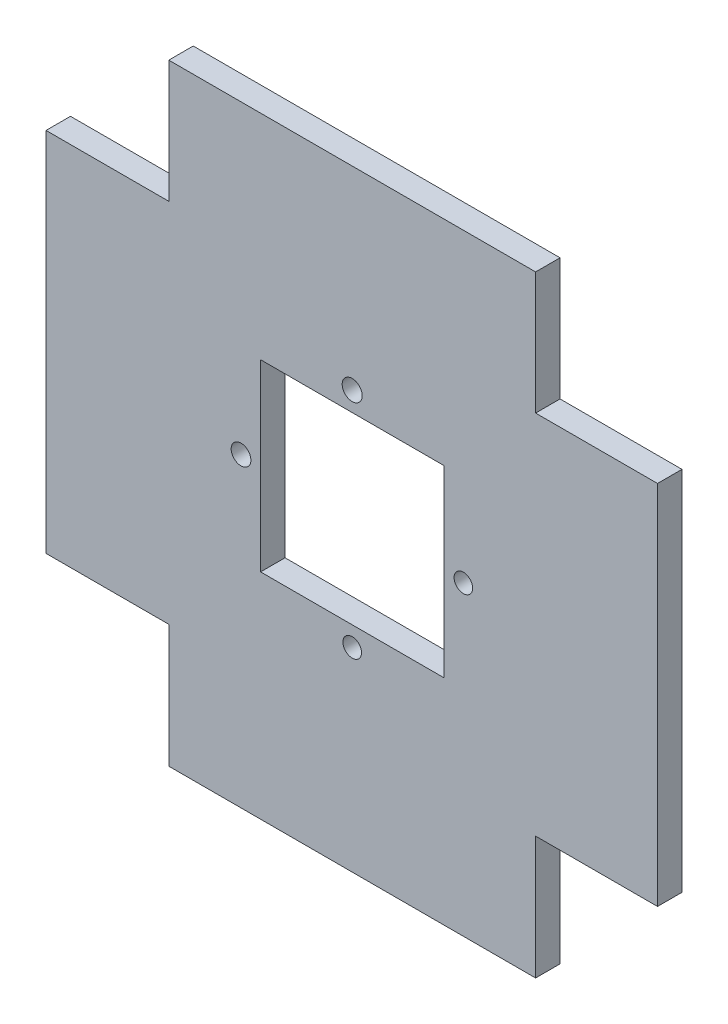
from build123d import *

# Parameters (mm, degrees)
SKETCH2_R           = 2.08028948
SKETCH2_R_2         = 1.930605223
SKETCH2_R_3         = 1.931643465
SKETCH2_R_4         = 2.051960052
SKETCH2_W           = 38.050309674
SKETCH2_H           = 38.166973502
BOSS_EXTRUDE1_DEPTH = 5.08


with BuildPart() as part:
    # Sketch2 → Boss-Extrude1 (new body)
    with BuildSketch(Plane.XY):
        Polygon((49.372044396, 30.512685118), (-26.811291054, 30.512685118), (-26.811291054, 5.122215891), (-52.307460203, 5.122215891), (-52.307460203, -70.962795052), (-26.811291054, -70.962795052), (-26.811291054, -96.487314882), (49.372044396, -96.487314882), (49.372044396, -70.962795052), (74.692539797, -70.962795052), (74.692539797, 5.122215891), (49.372044396, 5.122215891), align=None)
        with Locations((11.280376671, -9.772802829)):
            Circle(SKETCH2_R, mode=Mode.SUBTRACT)
        with Locations((34.369531508, -32.92028958)):
            Circle(SKETCH2_R_2, mode=Mode.SUBTRACT)
        with Locations((11.280376671, -56.067776331)):
            Circle(SKETCH2_R_3, mode=Mode.SUBTRACT)
        with Locations((-11.808778166, -32.92028958)):
            Circle(SKETCH2_R_4, mode=Mode.SUBTRACT)
        with Locations((11.280376671, -32.92028958)):
            Rectangle(SKETCH2_W, SKETCH2_H, mode=Mode.SUBTRACT)
    extrude(amount=BOSS_EXTRUDE1_DEPTH)


solid = part.part
